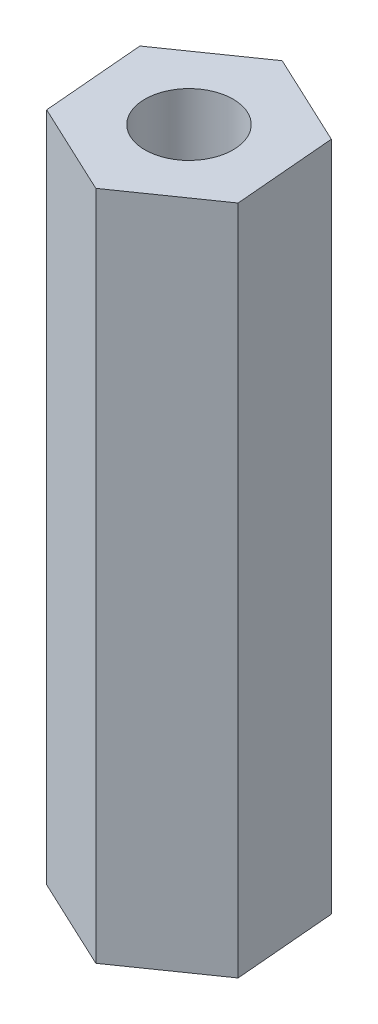
from build123d import *

# Parameters (mm, degrees)
SKETCH1_R           = 1.25
BOSS_EXTRUDE1_DEPTH = 19.05


with BuildPart() as part:
    # Sketch1 → Boss-Extrude1 (new body)
    with BuildSketch(Plane(origin=(0, 0, 0), x_dir=(1, 0, 0), z_dir=(0, 1, 0))):
        Polygon((2.626656848, -1.232920562), (2.381068951, 1.658291277), (-0.245587897, 2.891211839), (-2.626656848, 1.232920562), (-2.381068951, -1.658291277), (0.245587897, -2.891211839), align=None)
        Circle(SKETCH1_R, mode=Mode.SUBTRACT)
    extrude(amount=BOSS_EXTRUDE1_DEPTH)


solid = part.part
